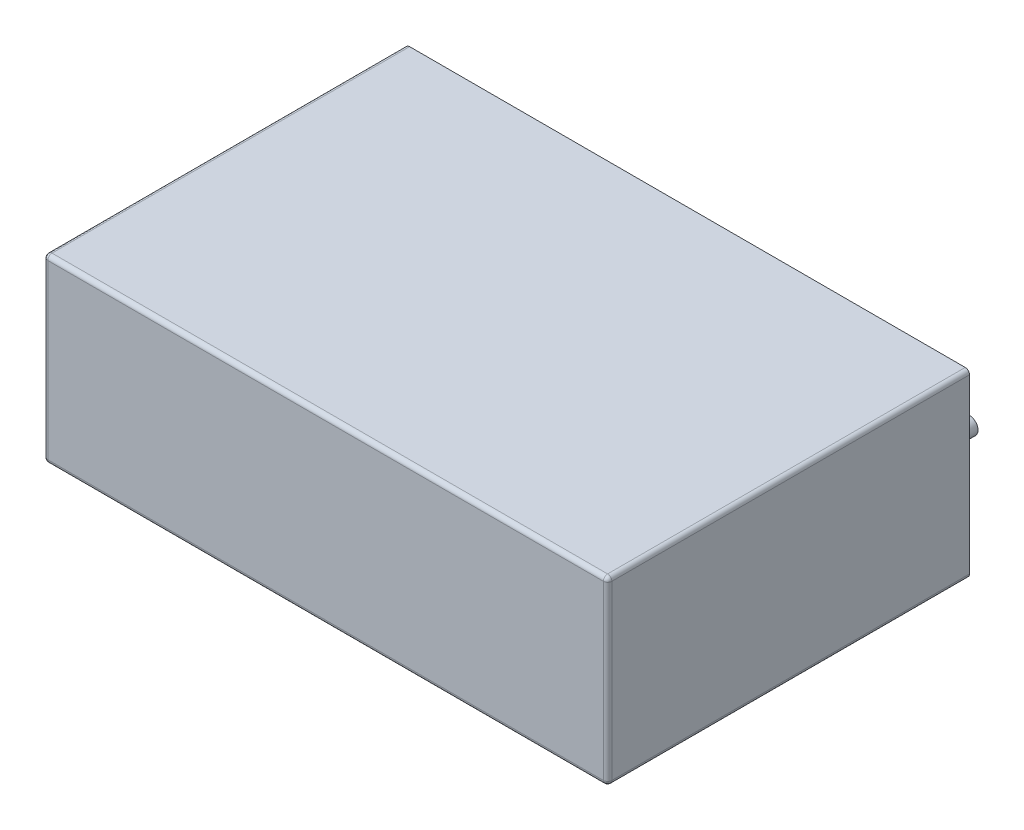
from build123d import *

# Parameters (mm, degrees)
SKETCH1_W               = 26.5
SKETCH1_H               = 8.5
EXTRUDE1_DEPTH          = 17
FILLET1_R               = 0.2
BOSS_EXTRUDE1_DEPTH     = 0.01
SKETCH4_W               = 26
SKETCH4_H               = 8
CUT_EXTRUDE1_DEPTH      = 0.5
CUT_EXTRUDE5_DEPTH      = 24.169214488
CUT_EXTRUDE5_DEPTH_BACK = 6
SKETCH5_W               = 19.5
SKETCH5_H               = 0.4
SKETCH2_R               = 0.4
EXTRUDE2_DEPTH          = 2.5


with BuildPart() as part:
    # Sketch1 → Extrude1 (new body)
    with BuildSketch(Plane.XY):
        Rectangle(SKETCH1_W, SKETCH1_H)
    extrude(amount=EXTRUDE1_DEPTH)

    # Fillet1
    fillet1_edges = [part.edges().sort_by_distance(p)[0] for p in [
        (13.25, 0, 17),
        (0, 4.25, 17),
        (-13.25, 0, 17),
        (0, -4.25, 17),
        (-13.25, 4.25, 8.5),
        (13.25, 4.25, 8.5),
        (13.25, -4.25, 8.5),
        (-13.25, -4.25, 8.5),
    ]]
    fillet(fillet1_edges, radius=FILLET1_R)

    # Sketch3 → Boss-Extrude1 (add)
    # profile 1 of 16: a face of its own
    with BuildSketch(Plane.XZ.offset(4.25)):
        Polygon((-4.080689103, 10.183093136), (-3.871121294, 11.770593136), (-3.85076873, 11.770593136), (-3.195352564, 10.468029033), (-2.541526442, 11.770593136), (-2.520855869, 11.770593136), (-2.310016026, 10.183093136), (-2.453119992, 10.183093136), (-2.605128205, 11.325380796), (-3.178180088, 10.183093136), (-3.210298978, 10.183093136), (-3.785576923, 11.327924866), (-3.937267127, 10.183093136), align=None)
    # profile 2 of 16: a face of its own
    with BuildSketch(Plane.XZ.offset(4.25)):
        Polygon((-1.984375, 11.770593136), (-1.841907051, 11.770593136), (-1.841907051, 11.16605838), (-1.180130709, 11.770593136), (-0.976923077, 11.770593136), (-1.756998698, 11.058253392), (-0.915865385, 10.183093136), (-1.105716647, 10.183093136), (-1.841907051, 10.949176369), (-1.841907051, 10.183093136), (-1.984375, 10.183093136), align=None)
    # profile 3 of 16: a face of its own
    with BuildSketch(Plane.XZ.offset(4.25)):
        with BuildLine():
            Line((-0.681810897, 11.770593136), (-0.370480268, 11.770593136))
            add(Edge.make_bspline(
                [(-0.370480268, 11.770593136), (-0.34906675, 11.770569597), (-0.308037499, 11.770524496), (-0.249202455, 11.769157093), (-0.195767327, 11.767330701), (-0.147847333, 11.764798914), (-0.105295031, 11.761806889), (-0.06830297, 11.757610428), (-0.036580386, 11.753228794), (-0.017572818, 11.748774085), (-0.008904247, 11.746742475)],
                knots=[0, 0, 0, 0, 1.415646017, 2.712440637, 3.8905458, 4.950247383, 5.884950622, 6.709939814, 7.411656543, 8, 8, 8, 8], degree=3))
            add(Edge.make_bspline(
                [(-0.008904247, 11.746742475), (0.002069249, 11.743738947), (0.023757664, 11.737802667), (0.055009208, 11.725912871), (0.084742559, 11.711814889), (0.113059731, 11.695747602), (0.139612747, 11.67702165), (0.164797773, 11.656396116), (0.188392549, 11.633394798), (0.210264395, 11.608275676), (0.230350714, 11.581460438), (0.247645249, 11.552548784), (0.262126526, 11.522027371), (0.274546796, 11.48991743), (0.283485988, 11.455949319), (0.290220117, 11.42035906), (0.294494406, 11.383150469), (0.294903782, 11.357723314), (0.295112179, 11.344779334)],
                knots=[0, 0, 0, 0, 0.999701418, 1.975846123, 2.934577507, 3.890451536, 4.834027766, 5.787354733, 6.749476667, 7.726910423, 8.712836071, 9.690891519, 10.682875813, 11.679750201, 12.712814741, 13.765529915, 14.8625177, 16, 16, 16, 16], degree=3))
            add(Edge.make_bspline(
                [(0.295112179, 11.344779334), (0.294921033, 11.331726556), (0.294547043, 11.306187916), (0.290058371, 11.268825973), (0.284012176, 11.23312156), (0.274715299, 11.199153845), (0.262538869, 11.167124549), (0.248254973, 11.136544205), (0.231026729, 11.107933068), (0.211230682, 11.081187268), (0.189209066, 11.056281701), (0.165055054, 11.033396847), (0.138866161, 11.012666665), (0.110725615, 10.994044681), (0.080359077, 10.977962725), (0.0482271, 10.963558519), (0.014050395, 10.951461288), (-0.00959996, 10.945097653), (-0.021624599, 10.941862166)],
                knots=[0, 0, 0, 0, 1.121902311, 2.195077645, 3.232258892, 4.234102512, 5.217864754, 6.176164875, 7.132989551, 8.084763148, 9.034132444, 9.988522005, 10.94243251, 11.903244335, 12.886203696, 13.894208494, 14.929344452, 16, 16, 16, 16], degree=3))
            add(Edge.make_bspline(
                [(-0.021624599, 10.941862166), (-0.031570212, 10.939747171), (-0.053366599, 10.935112037), (-0.089263477, 10.929937487), (-0.131057991, 10.925520789), (-0.178693096, 10.922209202), (-0.232126035, 10.919374213), (-0.291385713, 10.917120828), (-0.356588455, 10.915882644), (-0.402068626, 10.915818784), (-0.425813802, 10.915785443)],
                knots=[0, 0, 0, 0, 0.601384939, 1.31797006, 2.144135048, 3.087295005, 4.142315834, 5.309527816, 6.595305764, 8, 8, 8, 8], degree=3))
            Line((-0.425813802, 10.915785443), (-0.539342949, 10.915785443))
            Line((-0.539342949, 10.915785443), (-0.539342949, 10.183093136))
            Line((-0.539342949, 10.183093136), (-0.681810897, 10.183093136))
            Line((-0.681810897, 10.183093136), (-0.681810897, 11.770593136))
        make_face()
        with BuildLine():
            Line((-0.539342949, 11.607772623), (-0.539342949, 11.078605956))
            Line((-0.539342949, 11.078605956), (-0.261403245, 11.075107859))
            add(Edge.make_bspline(
                [(-0.261403245, 11.075107859), (-0.247832422, 11.075100845), (-0.221634227, 11.075087305), (-0.18378994, 11.076894889), (-0.148679299, 11.078981559), (-0.116410152, 11.082036781), (-0.086967953, 11.086355352), (-0.06030361, 11.090714962), (-0.036623878, 11.097022037), (-0.008911026, 11.105514286), (0.021969636, 11.119998008), (0.055564559, 11.141020994), (0.084035504, 11.167818315), (0.108672731, 11.197948081), (0.128224326, 11.231466615), (0.142537222, 11.267330026), (0.150946962, 11.305170515), (0.152074628, 11.331064063), (0.152644231, 11.344143316)],
                knots=[0, 0, 0, 0, 1.160613943, 2.240541288, 3.23993089, 4.169200891, 5.011653406, 5.7853311, 6.478053781, 7.106038997, 8.262395093, 9.384106736, 10.481365981, 11.59014053, 12.70357646, 13.786202915, 14.881775077, 16, 16, 16, 16], degree=3))
            add(Edge.make_bspline(
                [(0.152644231, 11.344143316), (0.15207153, 11.356906142), (0.150933073, 11.38227706), (0.142471306, 11.419460283), (0.128252153, 11.454945763), (0.108541484, 11.48804427), (0.084619614, 11.51806562), (0.056815983, 11.544144674), (0.02519604, 11.565109518), (-0.004217265, 11.578641042), (-0.030343517, 11.586902971), (-0.053036585, 11.592683666), (-0.078659141, 11.597299031), (-0.107219526, 11.601036234), (-0.138496376, 11.604235482), (-0.172758397, 11.606406265), (-0.2098758, 11.607676925), (-0.235643452, 11.607739951), (-0.249000901, 11.607772623)],
                knots=[0, 0, 0, 0, 1.120700087, 2.227813068, 3.331159281, 4.466773991, 5.599788987, 6.693661531, 7.80175334, 8.91857717, 9.525282508, 10.207424825, 10.974604443, 11.810962634, 12.737642355, 13.736264703, 14.826523623, 16, 16, 16, 16], degree=3))
            Line((-0.249000901, 11.607772623), (-0.539342949, 11.607772623))
        make_face(mode=Mode.SUBTRACT)
    # profile 4 of 16: a face of its own
    with BuildSketch(Plane.XZ.offset(4.25)):
        Polygon((1.119391026, 11.770593136), (1.283801583, 11.770593136), (1.699439103, 11.121219137), (2.115076623, 11.770593136), (2.279487179, 11.770593136), (1.781803385, 10.992743576), (2.299839744, 10.183093136), (2.135429187, 10.183093136), (1.699439103, 10.864268016), (1.263449018, 10.183093136), (1.099038462, 10.183093136), (1.617392829, 10.992743576), align=None)
    # profile 5 of 16: a face of its own
    with BuildSketch(Plane.XZ.offset(4.25)):
        with BuildLine():
            Line((2.635657051, 11.282131597), (2.493189103, 11.282131597))
            add(Edge.make_bspline(
                [(2.493189103, 11.282131597), (2.494117633, 11.301032321), (2.495941241, 11.33815284), (2.504481215, 11.392274755), (2.516700827, 11.444006753), (2.533978023, 11.492933464), (2.555434799, 11.539487495), (2.581165918, 11.58348393), (2.611643129, 11.624754934), (2.646208326, 11.662917909), (2.683749816, 11.697927986), (2.724256438, 11.728160899), (2.766821862, 11.753704986), (2.811316946, 11.775059692), (2.858243702, 11.791088837), (2.907176284, 11.802982223), (2.958329678, 11.810137923), (2.993182116, 11.810907083), (3.010907452, 11.811298264)],
                knots=[0, 0, 0, 0, 1.10065271, 2.161652631, 3.183658789, 4.190468796, 5.17591951, 6.163126047, 7.15150782, 8.156236427, 9.156009102, 10.134482811, 11.092018607, 12.041330605, 13.001268258, 13.972401359, 14.968799086, 16, 16, 16, 16], degree=3))
            add(Edge.make_bspline(
                [(3.010907452, 11.811298264), (3.02831465, 11.81089075), (3.062519172, 11.810089999), (3.112440157, 11.803213389), (3.159964144, 11.792443067), (3.204998238, 11.777332146), (3.247183132, 11.75701921), (3.286835727, 11.732618183), (3.324428095, 11.704397045), (3.3582676, 11.671171209), (3.389340908, 11.635700841), (3.416148002, 11.597833114), (3.439104687, 11.558721973), (3.458239813, 11.518069182), (3.47232599, 11.475491965), (3.483020392, 11.431610198), (3.489065326, 11.385969659), (3.489993071, 11.355078471), (3.490464744, 11.339373184)],
                knots=[0, 0, 0, 0, 1.111607364, 2.184268762, 3.212621178, 4.221274766, 5.211760367, 6.196651075, 7.1921475, 8.207485113, 9.220403448, 10.201281604, 11.166441695, 12.114753415, 13.065576456, 14.026450734, 14.996634279, 16, 16, 16, 16], degree=3))
            add(Edge.make_bspline(
                [(3.490464744, 11.339373184), (3.489696728, 11.317262559), (3.488174174, 11.273429319), (3.475150153, 11.209015435), (3.454809057, 11.146606991), (3.430317399, 11.096379715), (3.405610255, 11.055905952), (3.383345564, 11.022582646), (3.357281167, 10.986702666), (3.327037706, 10.948386159), (3.293240796, 10.907332999), (3.255584315, 10.863567984), (3.213799735, 10.817543289), (3.184472487, 10.786108248), (3.169275841, 10.769819398)],
                knots=[0, 0, 0, 0, 1.184426356, 2.348067706, 3.509069118, 4.696110526, 5.333549288, 6.050745305, 6.844228056, 7.710549037, 8.667450064, 9.695053472, 10.805634456, 12, 12, 12, 12], degree=3))
            Line((3.169275841, 10.769819398), (2.772082833, 10.345913649))
            Line((2.772082833, 10.345913649), (3.510817308, 10.345913649))
            Line((3.510817308, 10.345913649), (3.510817308, 10.183093136))
            Line((3.510817308, 10.183093136), (2.43213141, 10.183093136))
            Line((2.43213141, 10.183093136), (3.047796474, 10.840099346))
            add(Edge.make_bspline(
                [(3.047796474, 10.840099346), (3.062786052, 10.855746792), (3.091577962, 10.885802334), (3.132300773, 10.929682176), (3.168876314, 10.970390004), (3.201541346, 11.007848902), (3.229587258, 11.042606792), (3.254475734, 11.073537961), (3.27441727, 11.102001587), (3.29605961, 11.134994651), (3.317020952, 11.175277381), (3.335033342, 11.224505161), (3.346016505, 11.275181451), (3.347334056, 11.309427018), (3.347996795, 11.326652831)],
                knots=[0, 0, 0, 0, 1.329631726, 2.553950428, 3.673215718, 4.687767853, 5.603093632, 6.413772471, 7.123043292, 7.734684054, 8.834405432, 9.900288307, 10.943827018, 12, 12, 12, 12], degree=3))
            add(Edge.make_bspline(
                [(3.347996795, 11.326652831), (3.34770844, 11.337484751), (3.347140149, 11.358832385), (3.342124693, 11.390131426), (3.334545285, 11.420323324), (3.3236844, 11.449500948), (3.309348486, 11.47737094), (3.29189806, 11.503967225), (3.271763996, 11.52967972), (3.248472527, 11.553788538), (3.222885873, 11.575868942), (3.195855624, 11.595428795), (3.167257899, 11.611775106), (3.137213272, 11.625175192), (3.105805505, 11.635686883), (3.072973853, 11.642970595), (3.038809031, 11.647543722), (3.015480267, 11.648162471), (3.003593249, 11.648477751)],
                knots=[0, 0, 0, 0, 0.991446411, 1.95395049, 2.89581595, 3.838931463, 4.798493298, 5.75982156, 6.748411868, 7.785213223, 8.824556874, 9.840280684, 10.836137867, 11.835679398, 12.848801643, 13.863922112, 14.911575587, 16, 16, 16, 16], degree=3))
            add(Edge.make_bspline(
                [(3.003593249, 11.648477751), (2.991178621, 11.648153433), (2.966798342, 11.647516525), (2.931002924, 11.643061246), (2.896855446, 11.635375097), (2.864270012, 11.624862819), (2.833191485, 11.611501263), (2.803771008, 11.594858936), (2.776074626, 11.574999995), (2.750050275, 11.552484457), (2.726072684, 11.527416652), (2.705005708, 11.499472133), (2.686597959, 11.469161127), (2.670537342, 11.43656542), (2.657494583, 11.401389241), (2.64752819, 11.363757461), (2.639642013, 11.323833477), (2.637007434, 11.296263099), (2.635657051, 11.282131597)],
                knots=[0, 0, 0, 0, 1.031018746, 2.02475058, 2.990194455, 3.934040569, 4.864654155, 5.795059489, 6.735614925, 7.690564532, 8.649604399, 9.611025574, 10.590972636, 11.591080095, 12.624614302, 13.701020113, 14.821632451, 16, 16, 16, 16], degree=3))
        make_face()
    # profile 6 of 16: a face of its own
    with BuildSketch(Plane.XZ.offset(4.25)):
        Polygon((-2.410188802, 8.165464931), (-2.38125, 8.165464931), (-2.38125, 7.066426469), (-2.198076923, 7.066426469), (-2.198076923, 6.903605956), (-2.38125, 6.903605956), (-2.38125, 6.537259802), (-2.523717949, 6.537259802), (-2.523717949, 6.903605956), (-3.276762821, 6.903605956), align=None)
        Polygon((-2.523717949, 7.066426469), (-2.523717949, 7.755869578), (-2.996915064, 7.066426469), align=None, mode=Mode.SUBTRACT)
    # profile 7 of 16: a face of its own
    with BuildSketch(Plane.XZ.offset(4.25)):
        Polygon((-1.953846154, 8.124759802), (-0.976923077, 8.124759802), (-1.811378205, 6.496554674), (-1.934447616, 6.564290552), (-1.217973758, 7.96193929), (-1.953846154, 7.96193929), align=None)
    # profile 8 of 16: a face of its own
    with BuildSketch(Plane.XZ.offset(4.25)):
        with BuildLine():
            add(Edge.make_bspline(
                [(-0.834455128, 7.330373785), (-0.834306349, 7.355817957), (-0.834017342, 7.405243628), (-0.830802237, 7.477263805), (-0.825461278, 7.544827936), (-0.818141827, 7.607939256), (-0.8092346, 7.666614056), (-0.797344004, 7.720695535), (-0.783821769, 7.770434), (-0.768149766, 7.815991643), (-0.750466019, 7.857982244), (-0.731219051, 7.897182246), (-0.709645019, 7.933532337), (-0.686976919, 7.967612692), (-0.662297158, 7.998865439), (-0.636308064, 8.027731932), (-0.607995285, 8.053545023), (-0.578321277, 8.077061024), (-0.547017381, 8.097675606), (-0.514975886, 8.115833312), (-0.481976249, 8.131345395), (-0.447928373, 8.143542128), (-0.413138284, 8.153616334), (-0.377484365, 8.160505607), (-0.340907746, 8.164840347), (-0.316219202, 8.165254761), (-0.303698417, 8.165464931)],
                knots=[0, 0, 0, 0, 1.646270934, 3.197905019, 4.663502075, 6.030701355, 7.308322542, 8.50163776, 9.611534131, 10.641858119, 11.616356847, 12.558055219, 13.465016945, 14.349605745, 15.204443733, 16.039544428, 16.859896111, 17.680448484, 18.487036065, 19.28249412, 20.06191084, 20.843045899, 21.620316918, 22.403196591, 23.190181807, 24, 24, 24, 24], degree=3))
            add(Edge.make_bspline(
                [(-0.303698417, 8.165464931), (-0.29107304, 8.165243672), (-0.265965136, 8.164803657), (-0.22884468, 8.160574583), (-0.192581788, 8.153557324), (-0.157331061, 8.143614596), (-0.122802942, 8.131279414), (-0.0892675, 8.115818472), (-0.056516431, 8.097821271), (-0.025070194, 8.076674012), (0.005416436, 8.053096337), (0.034194619, 8.026443269), (0.061266976, 7.996983933), (0.086973275, 7.965033516), (0.110584206, 7.929979209), (0.133069299, 7.892430702), (0.153195187, 7.851731346), (0.172578414, 7.808560205), (0.189309297, 7.76172276), (0.204397916, 7.711483029), (0.216589448, 7.657247594), (0.226744582, 7.599301012), (0.234611732, 7.537430475), (0.240341537, 7.47176861), (0.243368258, 7.402272219), (0.243938262, 7.354757051), (0.244230769, 7.330373785)],
                knots=[0, 0, 0, 0, 0.810914788, 1.612654377, 2.396697861, 3.181598691, 3.963628158, 4.749916497, 5.551656086, 6.361998678, 7.18212741, 8.025565596, 8.878627764, 9.750805457, 10.657531673, 11.591944965, 12.560506719, 13.57287815, 14.630710178, 15.753379473, 16.941251878, 18.199788006, 19.531962791, 20.947069417, 22.433333509, 24, 24, 24, 24], degree=3))
            add(Edge.make_bspline(
                [(0.244230769, 7.330373785), (0.243935229, 7.306096869), (0.243359381, 7.25879429), (0.240375468, 7.189610597), (0.234497803, 7.124297199), (0.227145415, 7.062697454), (0.2169623, 7.005067748), (0.204441385, 6.951208659), (0.190539275, 6.900887598), (0.173378493, 6.854516808), (0.154595778, 6.81144942), (0.134160028, 6.771232535), (0.112266214, 6.73351068), (0.088413462, 6.698585795), (0.062989235, 6.666210476), (0.035449381, 6.636956197), (0.006570223, 6.610118071), (-0.024006123, 6.586236797), (-0.055942791, 6.565334046), (-0.088581372, 6.546640621), (-0.122500978, 6.53156722), (-0.156932924, 6.518624541), (-0.192369719, 6.508736479), (-0.228767189, 6.501899409), (-0.265940196, 6.49710432), (-0.291068763, 6.496738524), (-0.303698417, 6.496554674)],
                knots=[0, 0, 0, 0, 1.561518951, 3.042555995, 4.452378317, 5.7783523, 7.031515105, 8.214008947, 9.334062868, 10.386615937, 11.391082383, 12.354592575, 13.286541444, 14.194233754, 15.072674879, 15.931287219, 16.775624067, 17.606195743, 18.42308326, 19.229000347, 20.022332153, 20.807536673, 21.593273796, 22.3848459, 23.188221202, 24, 24, 24, 24], degree=3))
            add(Edge.make_bspline(
                [(-0.303698417, 6.496554674), (-0.316218855, 6.4967662), (-0.340906714, 6.497183287), (-0.377488349, 6.501498443), (-0.412995029, 6.508436047), (-0.447601964, 6.518150006), (-0.481486705, 6.530040307), (-0.514187521, 6.545531442), (-0.546068006, 6.563372252), (-0.577043104, 6.583690175), (-0.606530763, 6.606968225), (-0.634696916, 6.632714884), (-0.660833978, 6.661572646), (-0.685160872, 6.693085846), (-0.708281262, 6.726964567), (-0.729548942, 6.763671365), (-0.749220722, 6.803060692), (-0.767201877, 6.84538703), (-0.783144306, 6.891268015), (-0.79722666, 6.941228535), (-0.808345581, 6.995709556), (-0.81786285, 7.054273505), (-0.825539267, 7.117172037), (-0.830779978, 7.184439301), (-0.834019075, 7.256033378), (-0.834307125, 7.305141454), (-0.834455128, 7.330373785)],
                knots=[0, 0, 0, 0, 0.810891512, 1.598919785, 2.382837074, 3.152667961, 3.926044502, 4.706494248, 5.493654104, 6.291793342, 7.103789334, 7.925228297, 8.761435821, 9.622817696, 10.50288917, 11.416980706, 12.369136599, 13.353924996, 14.394355917, 15.514179734, 16.714354668, 17.994756427, 19.357759367, 20.818452758, 22.365282078, 24, 24, 24, 24], degree=3))
        make_face()
        with BuildLine():
            add(Edge.make_bspline(
                [(-0.691987179, 7.331009802), (-0.691933002, 7.309805928), (-0.691827853, 7.268653372), (-0.689080934, 7.208853036), (-0.685338864, 7.153077208), (-0.680512276, 7.101255069), (-0.67334451, 7.053562027), (-0.665313217, 7.009670064), (-0.655539619, 6.96981146), (-0.643975807, 6.933712703), (-0.630804503, 6.900761161), (-0.616423629, 6.870099181), (-0.600974658, 6.841364553), (-0.583684901, 6.814815381), (-0.564854854, 6.790365085), (-0.54490984, 6.767580907), (-0.523105489, 6.747262276), (-0.492941292, 6.72289331), (-0.453119319, 6.697711417), (-0.402945042, 6.675783012), (-0.35138828, 6.662002398), (-0.316394677, 6.660249909), (-0.298928285, 6.659375187)],
                knots=[0, 0, 0, 0, 1.459021318, 2.831673884, 4.118529203, 5.306027144, 6.411944654, 7.436330062, 8.375795394, 9.233974572, 10.042671642, 10.816086306, 11.563610507, 12.285937304, 12.993564865, 13.685989202, 14.367179055, 15.041617293, 16.353048772, 17.594441528, 18.799311195, 20, 20, 20, 20], degree=3))
            add(Edge.make_bspline(
                [(-0.298928285, 6.659375187), (-0.281348913, 6.660099895), (-0.246226463, 6.661547814), (-0.194912206, 6.675517241), (-0.145096333, 6.696594497), (-0.10605656, 6.721517115), (-0.076355549, 6.74525175), (-0.055075343, 6.76548768), (-0.035543628, 6.788146234), (-0.01701883, 6.812593415), (-2.8464e-05, 6.839296292), (0.015421602, 6.86812646), (0.029520121, 6.89916398), (0.037552438, 6.920830968), (0.041659155, 6.931908741)],
                knots=[0, 0, 0, 0, 1.353760809, 2.704726607, 4.075137775, 5.516104923, 6.260822281, 7.007110065, 7.778089737, 8.566572457, 9.372053459, 10.217411131, 11.088608312, 12, 12, 12, 12], degree=3))
            add(Edge.make_bspline(
                [(0.041659155, 6.931908741), (0.046445135, 6.946073658), (0.056162728, 6.974834516), (0.06868664, 7.019449458), (0.078549731, 7.066259283), (0.087423115, 7.114984246), (0.09347968, 7.165983682), (0.098354581, 7.219099792), (0.101226, 7.274372624), (0.10158194, 7.311926067), (0.101762821, 7.331009802)],
                knots=[0, 0, 0, 0, 0.884706709, 1.796334032, 2.740027952, 3.714592787, 4.726048262, 5.777819803, 6.87074269, 8, 8, 8, 8], degree=3))
            add(Edge.make_bspline(
                [(0.101762821, 7.331009802), (0.10151327, 7.350090451), (0.101025097, 7.38741628), (0.09915911, 7.442079883), (0.09434056, 7.493999189), (0.088988817, 7.543397868), (0.081097934, 7.590002469), (0.072589929, 7.634203143), (0.061159379, 7.675452301), (0.048949338, 7.714395754), (0.034974623, 7.750591051), (0.019591415, 7.784206947), (0.00316226, 7.815405733), (-0.014682256, 7.84410181), (-0.033730298, 7.870423713), (-0.054484615, 7.89384369), (-0.076121955, 7.915087601), (-0.106428322, 7.939336694), (-0.14610416, 7.964061642), (-0.195473436, 7.986815397), (-0.246849764, 7.999882016), (-0.281581295, 8.001724281), (-0.298928285, 8.002644418)],
                knots=[0, 0, 0, 0, 1.31362396, 2.569729283, 3.763502607, 4.902122613, 5.988968491, 7.01645872, 7.998833611, 8.933434873, 9.825090667, 10.667526885, 11.477055099, 12.250526234, 12.991942729, 13.710640831, 14.402115721, 15.076753259, 16.378508321, 17.609869233, 18.806226677, 20, 20, 20, 20], degree=3))
            add(Edge.make_bspline(
                [(-0.298928285, 8.002644418), (-0.316486304, 8.001723012), (-0.351634327, 7.999878521), (-0.40354465, 7.986864081), (-0.453303409, 7.964179628), (-0.49287433, 7.939254802), (-0.523201833, 7.91551564), (-0.544557198, 7.894929641), (-0.56458064, 7.872411518), (-0.583026347, 7.847736364), (-0.600302557, 7.821218144), (-0.616168945, 7.79264824), (-0.630464305, 7.761881871), (-0.64365622, 7.728945131), (-0.655255306, 7.692849488), (-0.664822925, 7.65303998), (-0.673661696, 7.609287622), (-0.679918835, 7.561336274), (-0.685481325, 7.509501154), (-0.689056079, 7.453586085), (-0.691837042, 7.393685455), (-0.691936131, 7.352320123), (-0.691987179, 7.331009802)],
                knots=[0, 0, 0, 0, 1.207732386, 2.417664972, 3.655092373, 4.956220595, 5.625982001, 6.301752483, 6.994047911, 7.697131622, 8.419323945, 9.170223765, 9.943494443, 10.752040957, 11.610060368, 12.549350801, 13.567764191, 14.679664412, 15.874934091, 17.154273443, 18.533957287, 20, 20, 20, 20], degree=3))
        make_face(mode=Mode.SUBTRACT)
    # profile 9 of 16: a face of its own
    with BuildSketch(Plane.XZ.offset(4.25)):
        with BuildLine():
            Line((0.488461538, 7.697355956), (0.630929487, 7.697355956))
            Line((0.630929487, 7.697355956), (0.630929487, 7.488106157))
            add(Edge.make_bspline(
                [(0.630929487, 7.488106157), (0.6461412, 7.50708482), (0.67566006, 7.543913579), (0.724820097, 7.592318982), (0.776773938, 7.632208424), (0.831203418, 7.664005502), (0.888182426, 7.687975221), (0.947363641, 7.705286197), (1.009101383, 7.715666102), (1.051085967, 7.717022385), (1.072325721, 7.71770852)],
                knots=[0, 0, 0, 0, 1.12780773, 2.188550248, 3.19190651, 4.159438251, 5.104880172, 6.052711206, 7.014878035, 8, 8, 8, 8], degree=3))
            add(Edge.make_bspline(
                [(1.072325721, 7.71770852), (1.093793544, 7.71691695), (1.135811253, 7.715367655), (1.196988088, 7.703113655), (1.25412602, 7.682183486), (1.307021319, 7.653512297), (1.354704019, 7.617858647), (1.396579934, 7.576321581), (1.431216121, 7.528544144), (1.454437782, 7.484219712), (1.469734772, 7.444900152), (1.479365154, 7.411223947), (1.487543492, 7.373705357), (1.494633606, 7.332457758), (1.499431082, 7.28719215), (1.503214907, 7.23809409), (1.505926672, 7.185179481), (1.506034262, 7.148582332), (1.506089744, 7.129710223)],
                knots=[0, 0, 0, 0, 1.235846778, 2.418850247, 3.575807741, 4.728682307, 5.871620074, 6.994088408, 8.11269785, 9.256955736, 9.865816715, 10.540099792, 11.271859618, 12.076849838, 12.949306005, 13.892391288, 14.913166135, 16, 16, 16, 16], degree=3))
            Line((1.506089744, 7.129710223), (1.506089744, 6.537259802))
            Line((1.506089744, 6.537259802), (1.363621795, 6.537259802))
            Line((1.363621795, 6.537259802), (1.363621795, 7.082962927))
            add(Edge.make_bspline(
                [(1.363621795, 7.082962927), (1.363534161, 7.098757393), (1.363366533, 7.128969519), (1.362837829, 7.172226183), (1.361563381, 7.211454024), (1.359772539, 7.246559259), (1.357151336, 7.277508177), (1.354419642, 7.304363814), (1.351079099, 7.32709207), (1.348102349, 7.34077409), (1.346767328, 7.346910243)],
                knots=[0, 0, 0, 0, 1.430800155, 2.736877192, 3.918605307, 4.986035426, 5.920637409, 6.731861385, 7.431261377, 8, 8, 8, 8], degree=3))
            add(Edge.make_bspline(
                [(1.346767328, 7.346910243), (1.34194789, 7.364922102), (1.332671964, 7.399589358), (1.309751193, 7.446613082), (1.280806904, 7.48661726), (1.245474665, 7.519354559), (1.204095763, 7.544832045), (1.156785023, 7.562509518), (1.103998997, 7.573565897), (1.066872188, 7.574666775), (1.047521034, 7.575240572)],
                knots=[0, 0, 0, 0, 1.084156227, 2.086665306, 3.027808233, 3.945421172, 4.874247719, 5.839848303, 6.874090471, 8, 8, 8, 8], degree=3))
            add(Edge.make_bspline(
                [(1.047521034, 7.575240572), (1.036060334, 7.575024669), (1.013379906, 7.574597405), (0.979747598, 7.570310566), (0.947124848, 7.563299052), (0.915184253, 7.553833635), (0.884564647, 7.540833248), (0.854282272, 7.526078855), (0.825477418, 7.507687345), (0.797535877, 7.48719017), (0.771540425, 7.464475672), (0.747352214, 7.440506913), (0.725790327, 7.414981907), (0.706255606, 7.38831193), (0.689392608, 7.360130704), (0.674672814, 7.330710108), (0.66218341, 7.300011419), (0.655977332, 7.278704873), (0.652872095, 7.268044057)],
                knots=[0, 0, 0, 0, 1.023777757, 2.026029729, 3.023749952, 4.003683103, 4.997618607, 5.993177895, 7.010360494, 8.046726602, 9.087585522, 10.09234134, 11.086953743, 12.070360549, 13.043493632, 14.017870808, 15.008233677, 16, 16, 16, 16], degree=3))
            add(Edge.make_bspline(
                [(0.652872095, 7.268044057), (0.651085183, 7.26021759), (0.647195169, 7.243179781), (0.642993656, 7.215219633), (0.63918022, 7.182875466), (0.635988456, 7.146185022), (0.634035642, 7.105019843), (0.631906398, 7.059555731), (0.631131217, 7.009611399), (0.630998613, 6.974839845), (0.630929487, 6.956713428)],
                knots=[0, 0, 0, 0, 0.615963638, 1.340920617, 2.168419149, 3.115676021, 4.16674242, 5.331190069, 6.6087489, 8, 8, 8, 8], degree=3))
            Line((0.630929487, 6.956713428), (0.630929487, 6.537259802))
            Line((0.630929487, 6.537259802), (0.488461538, 6.537259802))
            Line((0.488461538, 6.537259802), (0.488461538, 7.697355956))
        make_face()
    # profile 10 of 16: a face of its own
    with BuildSketch(Plane.XZ.offset(4.25)):
        Polygon((1.872435897, 8.124759802), (2.645833333, 8.124759802), (2.645833333, 7.96193929), (2.014903846, 7.96193929), (2.014903846, 7.473477751), (2.645833333, 7.473477751), (2.645833333, 7.310657238), (2.014903846, 7.310657238), (2.014903846, 6.537259802), (1.872435897, 6.537259802), align=None)
    # profile 11 of 16: a face of its own
    with BuildSketch(Plane.XZ.offset(4.25)):
        with BuildLine():
            Line((-4.365625, 3.990464931), (-4.508092949, 3.990464931))
            add(Edge.make_bspline(
                [(-4.508092949, 3.990464931), (-4.507164419, 4.009365655), (-4.50534081, 4.046486174), (-4.496800836, 4.100608088), (-4.484581224, 4.152340086), (-4.467304029, 4.201266797), (-4.445847253, 4.247820828), (-4.420116133, 4.291817264), (-4.389638922, 4.333088267), (-4.355073725, 4.371251242), (-4.317532235, 4.406261319), (-4.277025613, 4.436494233), (-4.23446019, 4.462038319), (-4.189965105, 4.483393026), (-4.14303835, 4.49942217), (-4.094105768, 4.511315557), (-4.042952374, 4.518471256), (-4.008099935, 4.519240416), (-3.990374599, 4.519631597)],
                knots=[0, 0, 0, 0, 1.10065271, 2.161652631, 3.183658789, 4.190468796, 5.17591951, 6.163126047, 7.15150782, 8.156236427, 9.156009102, 10.134482811, 11.092018607, 12.041330605, 13.001268258, 13.972401359, 14.968799086, 16, 16, 16, 16], degree=3))
            add(Edge.make_bspline(
                [(-3.990374599, 4.519631597), (-3.972967401, 4.519224083), (-3.938762879, 4.518423332), (-3.888841894, 4.511546723), (-3.841317907, 4.500776401), (-3.796283813, 4.48566548), (-3.754098919, 4.465352543), (-3.714446324, 4.440951517), (-3.676853957, 4.412730379), (-3.643014451, 4.379504542), (-3.611941144, 4.344034175), (-3.585134049, 4.306166447), (-3.562177365, 4.267055307), (-3.543042238, 4.226402515), (-3.528956061, 4.183825299), (-3.51826166, 4.139943532), (-3.512216725, 4.094302992), (-3.51128898, 4.063411805), (-3.510817308, 4.047706517)],
                knots=[0, 0, 0, 0, 1.111607364, 2.184268762, 3.212621178, 4.221274766, 5.211760367, 6.196651075, 7.1921475, 8.207485113, 9.220403448, 10.201281604, 11.166441695, 12.114753415, 13.065576456, 14.026450734, 14.996634279, 16, 16, 16, 16], degree=3))
            add(Edge.make_bspline(
                [(-3.510817308, 4.047706517), (-3.511585323, 4.025595892), (-3.513107877, 3.981762652), (-3.526131898, 3.917348768), (-3.546472994, 3.854940325), (-3.570964652, 3.804713048), (-3.595671797, 3.764239285), (-3.617936487, 3.73091598), (-3.644000884, 3.695035999), (-3.674244345, 3.656719493), (-3.708041255, 3.615666332), (-3.745697737, 3.571901318), (-3.787482316, 3.525876622), (-3.816809564, 3.494441582), (-3.83200621, 3.478152731)],
                knots=[0, 0, 0, 0, 1.184426356, 2.348067706, 3.509069118, 4.696110526, 5.333549288, 6.050745305, 6.844228056, 7.710549037, 8.667450064, 9.695053472, 10.805634456, 12, 12, 12, 12], degree=3))
            Line((-3.83200621, 3.478152731), (-4.229199219, 3.054246982))
            Line((-4.229199219, 3.054246982), (-3.490464744, 3.054246982))
            Line((-3.490464744, 3.054246982), (-3.490464744, 2.891426469))
            Line((-3.490464744, 2.891426469), (-4.569150641, 2.891426469))
            Line((-4.569150641, 2.891426469), (-3.953485577, 3.548432679))
            add(Edge.make_bspline(
                [(-3.953485577, 3.548432679), (-3.938496, 3.564080125), (-3.90970409, 3.594135667), (-3.868981278, 3.63801551), (-3.832405737, 3.678723337), (-3.799740705, 3.716182236), (-3.771694794, 3.750940125), (-3.746806317, 3.781871295), (-3.726864781, 3.81033492), (-3.705222441, 3.843327984), (-3.684261099, 3.883610714), (-3.666248709, 3.932838494), (-3.655265546, 3.983514784), (-3.653947996, 4.017760351), (-3.653285256, 4.034986165)],
                knots=[0, 0, 0, 0, 1.329631726, 2.553950428, 3.673215718, 4.687767853, 5.603093632, 6.413772471, 7.123043292, 7.734684054, 8.834405432, 9.900288307, 10.943827018, 12, 12, 12, 12], degree=3))
            add(Edge.make_bspline(
                [(-3.653285256, 4.034986165), (-3.653573611, 4.045818085), (-3.654141902, 4.067165719), (-3.659157358, 4.09846476), (-3.666736766, 4.128656657), (-3.677597651, 4.157834281), (-3.691933565, 4.185704273), (-3.709383991, 4.212300559), (-3.729518056, 4.238013054), (-3.752809524, 4.262121871), (-3.778396178, 4.284202275), (-3.805426427, 4.303762128), (-3.834024153, 4.320108439), (-3.86406878, 4.333508525), (-3.895476546, 4.344020216), (-3.928308198, 4.351303929), (-3.96247302, 4.355877055), (-3.985801784, 4.356495805), (-3.997688802, 4.356811084)],
                knots=[0, 0, 0, 0, 0.991446411, 1.95395049, 2.89581595, 3.838931463, 4.798493298, 5.75982156, 6.748411868, 7.785213223, 8.824556874, 9.840280684, 10.836137867, 11.835679398, 12.848801643, 13.863922112, 14.911575587, 16, 16, 16, 16], degree=3))
            add(Edge.make_bspline(
                [(-3.997688802, 4.356811084), (-4.01010343, 4.356486766), (-4.034483709, 4.355849859), (-4.070279127, 4.351394579), (-4.104426605, 4.34370843), (-4.13701204, 4.333196153), (-4.168090566, 4.319834597), (-4.197511043, 4.30319227), (-4.225207425, 4.283333328), (-4.251231777, 4.26081779), (-4.275209367, 4.235749985), (-4.296276343, 4.207805466), (-4.314684092, 4.17749446), (-4.330744709, 4.144898753), (-4.343787468, 4.109722574), (-4.353753862, 4.072090794), (-4.361640038, 4.03216681), (-4.364274617, 4.004596432), (-4.365625, 3.990464931)],
                knots=[0, 0, 0, 0, 1.031018746, 2.02475058, 2.990194455, 3.934040569, 4.864654155, 5.795059489, 6.735614925, 7.690564532, 8.649604399, 9.611025574, 10.590972636, 11.591080095, 12.624614302, 13.701020113, 14.821632451, 16, 16, 16, 16], degree=3))
        make_face()
    # profile 12 of 16: a face of its own
    with BuildSketch(Plane.XZ.offset(4.25)):
        Polygon((-3.246233974, 4.478926469), (-2.269310897, 4.478926469), (-3.103766026, 2.850721341), (-3.226835437, 2.918457218), (-2.510361579, 4.316105956), (-3.246233974, 4.316105956), align=None)
    # profile 13 of 16: a face of its own
    with BuildSketch(Plane.XZ.offset(4.25)):
        with BuildLine():
            Line((-1.129567308, 4.478926469), (-1.129567308, 4.316105956))
            Line((-1.129567308, 4.316105956), (-1.669546274, 4.316105956))
            Line((-1.669546274, 4.316105956), (-1.755090645, 3.898560383))
            add(Edge.make_bspline(
                [(-1.755090645, 3.898560383), (-1.738283159, 3.903200542), (-1.705721314, 3.912190116), (-1.657660948, 3.922171305), (-1.612035199, 3.928188132), (-1.582428156, 3.92900969), (-1.568101462, 3.929407238)],
                knots=[0, 0, 0, 0, 1.100273476, 2.13160584, 3.095893838, 4, 4, 4, 4], degree=3))
            add(Edge.make_bspline(
                [(-1.568101462, 3.929407238), (-1.550374195, 3.929023546), (-1.515517957, 3.928269111), (-1.464518864, 3.921024737), (-1.41583573, 3.90962199), (-1.369570369, 3.893692324), (-1.325637191, 3.873322553), (-1.284440404, 3.847877222), (-1.245361636, 3.818153176), (-1.20910196, 3.783978831), (-1.176207006, 3.746367955), (-1.147284575, 3.705928492), (-1.122717971, 3.663053445), (-1.102960057, 3.617333169), (-1.087182877, 3.569273125), (-1.076681794, 3.518367632), (-1.069689215, 3.46509652), (-1.06890799, 3.428672662), (-1.068509615, 3.410098845)],
                knots=[0, 0, 0, 0, 1.052922333, 2.070308379, 3.05430497, 4.020497103, 4.973039431, 5.925935799, 6.892292201, 7.88610001, 8.88166317, 9.857072816, 10.836096531, 11.812156883, 12.81219415, 13.836441305, 14.89672472, 16, 16, 16, 16], degree=3))
            add(Edge.make_bspline(
                [(-1.068509615, 3.410098845), (-1.068811275, 3.397161981), (-1.069410516, 3.371463083), (-1.072457876, 3.333297677), (-1.078325147, 3.29594025), (-1.08620265, 3.259385843), (-1.096427247, 3.223703664), (-1.108804782, 3.188791578), (-1.123952266, 3.154866881), (-1.140567211, 3.121608577), (-1.159275435, 3.08976854), (-1.180039258, 3.059992035), (-1.201976463, 3.031832379), (-1.225580949, 3.005591579), (-1.251072114, 2.981442067), (-1.278141242, 2.959240525), (-1.306572333, 2.938611493), (-1.336805246, 2.920392347), (-1.368166301, 2.903627007), (-1.401108385, 2.889873116), (-1.434881631, 2.877576555), (-1.469972128, 2.867775091), (-1.506300393, 2.860094968), (-1.543926309, 2.854878624), (-1.582652542, 2.851079312), (-1.608902994, 2.850841478), (-1.622162961, 2.850721341)],
                knots=[0, 0, 0, 0, 1.056347294, 2.098418968, 3.122841568, 4.141288669, 5.149314143, 6.15115421, 7.162517403, 8.180376062, 9.185164535, 10.17417709, 11.141909838, 12.097768115, 13.052685741, 14.0056014, 14.954263652, 15.917497458, 16.885230207, 17.854509472, 18.828990115, 19.81800267, 20.826176721, 21.857883937, 22.917946725, 24, 24, 24, 24], degree=3))
            add(Edge.make_bspline(
                [(-1.622162961, 2.850721341), (-1.637980893, 2.851034685), (-1.669100805, 2.851651153), (-1.714694062, 2.858100252), (-1.758561044, 2.867336743), (-1.800348626, 2.881232479), (-1.840431306, 2.898643859), (-1.878269467, 2.920649409), (-1.914829944, 2.945586359), (-1.948626475, 2.975014234), (-1.979993713, 3.007179561), (-2.008072736, 3.042085348), (-2.033079751, 3.079155488), (-2.054614301, 3.118570008), (-2.072983046, 3.160225341), (-2.087413416, 3.20427756), (-2.099060384, 3.25049649), (-2.103987721, 3.282316118), (-2.106490385, 3.298477751)],
                knots=[0, 0, 0, 0, 1.0467383, 2.05933395, 3.04377827, 4.011590433, 4.970194871, 5.932262533, 6.905835911, 7.896367577, 8.894135286, 9.877477877, 10.858688626, 11.851381753, 12.8477658, 13.868841284, 14.917554742, 16, 16, 16, 16], degree=3))
            Line((-2.106490385, 3.298477751), (-1.964022436, 3.298477751))
            add(Edge.make_bspline(
                [(-1.964022436, 3.298477751), (-1.960516983, 3.283339146), (-1.953779308, 3.254241906), (-1.938990272, 3.213360905), (-1.92090825, 3.1769304), (-1.899406992, 3.144468482), (-1.873757514, 3.116161544), (-1.844488809, 3.090935233), (-1.811673948, 3.068177228), (-1.775209876, 3.049207616), (-1.736741087, 3.033029289), (-1.696478817, 3.022256198), (-1.655519345, 3.014681151), (-1.627815942, 3.013922888), (-1.613894732, 3.013541854)],
                knots=[0, 0, 0, 0, 1.136247022, 2.183929868, 3.172523383, 4.106158343, 5.02341133, 5.958108904, 6.928429099, 7.938127109, 8.96079061, 9.975095812, 10.982467395, 12, 12, 12, 12], degree=3))
            add(Edge.make_bspline(
                [(-1.613894732, 3.013541854), (-1.600306437, 3.013914135), (-1.573550974, 3.01464716), (-1.53417581, 3.020289141), (-1.496160684, 3.028978468), (-1.459880705, 3.041982295), (-1.424701006, 3.057786863), (-1.391511475, 3.078068344), (-1.359351956, 3.101409138), (-1.329222052, 3.128150181), (-1.301627016, 3.157618578), (-1.277244776, 3.189131539), (-1.256935247, 3.222748823), (-1.239820133, 3.257888432), (-1.226823816, 3.294935492), (-1.217552371, 3.333716382), (-1.212108126, 3.374326891), (-1.211359198, 3.402026185), (-1.210977564, 3.416141012)],
                knots=[0, 0, 0, 0, 1.027316725, 2.022795036, 3.002884548, 3.971462791, 4.93288096, 5.914575861, 6.907176829, 7.935150275, 8.956128384, 9.956726525, 10.942570165, 11.921478529, 12.907843606, 13.90538589, 14.932640048, 16, 16, 16, 16], degree=3))
            add(Edge.make_bspline(
                [(-1.210977564, 3.416141012), (-1.211276232, 3.428875371), (-1.211860831, 3.453801066), (-1.216637196, 3.490267849), (-1.224945252, 3.524772408), (-1.236476797, 3.557481364), (-1.25111786, 3.588425568), (-1.26900958, 3.617636956), (-1.290487728, 3.644730516), (-1.315022264, 3.669718925), (-1.341900018, 3.692780707), (-1.37158343, 3.712440346), (-1.403451325, 3.728979337), (-1.43711975, 3.743252322), (-1.473389544, 3.753503375), (-1.511542445, 3.761199523), (-1.551990452, 3.765651491), (-1.579645014, 3.766269205), (-1.593860176, 3.766586725)],
                knots=[0, 0, 0, 0, 1.045622112, 2.046656509, 3.013763289, 3.955457236, 4.890082067, 5.820317437, 6.762574623, 7.722996705, 8.69280354, 9.665887285, 10.63943826, 11.638615906, 12.663482002, 13.728887084, 14.832589034, 16, 16, 16, 16], degree=3))
            add(Edge.make_bspline(
                [(-1.593860176, 3.766586725), (-1.606165083, 3.766323386), (-1.631571594, 3.765779657), (-1.670543734, 3.76177621), (-1.711497479, 3.755317673), (-1.75427584, 3.74643391), (-1.799007285, 3.734808386), (-1.845597416, 3.720877166), (-1.894144195, 3.704221117), (-1.926854734, 3.691642577), (-1.943669872, 3.685176469)],
                knots=[0, 0, 0, 0, 0.817624296, 1.688186739, 2.600797293, 3.572016777, 4.590301741, 5.671205678, 6.80286297, 8, 8, 8, 8], degree=3))
            Line((-1.943669872, 3.685176469), (-1.780849359, 4.478926469))
            Line((-1.780849359, 4.478926469), (-1.129567308, 4.478926469))
        make_face()
    # profile 14 of 16: a face of its own
    with BuildSketch(Plane.XZ.offset(4.25)):
        Polygon((-0.885336538, 4.478926469), (-0.732692308, 4.478926469), (-0.203525641, 3.227879794), (0.325641026, 4.478926469), (0.478285256, 4.478926469), (-0.193349359, 2.891426469), (-0.213701923, 2.891426469), align=None)
    # profile 15 of 16: a face of its own
    with BuildSketch(Plane.XZ.offset(4.25)):
        Polygon((2.025080128, 4.478926469), (2.757772436, 2.891426469), (2.602902143, 2.891426469), (2.368211639, 3.400240572), (1.648557692, 3.400240572), (1.407189002, 2.891426469), (1.251682692, 2.891426469), (2.004727564, 4.478926469), align=None)
        Polygon((2.013313802, 4.169503893), (1.725833834, 3.563061084), (2.293161558, 3.563061084), align=None, mode=Mode.SUBTRACT)
    # profile 16 of 16: a face of its own
    with BuildSketch(Plane.XZ.offset(4.25)):
        with BuildLine():
            Line((4.508092949, 4.187630395), (4.383433494, 4.092227751))
            add(Edge.make_bspline(
                [(4.383433494, 4.092227751), (4.374540823, 4.102825887), (4.356875374, 4.123879274), (4.32845495, 4.153442853), (4.29883599, 4.181140311), (4.268029817, 4.207103592), (4.235481931, 4.230424768), (4.201980783, 4.252319161), (4.166965955, 4.271944171), (4.118546419, 4.295739883), (4.055206145, 4.320571174), (3.975470628, 4.341391568), (3.892235237, 4.354645459), (3.835449183, 4.356080941), (3.806565505, 4.356811084)],
                knots=[0, 0, 0, 0, 0.757959112, 1.505699292, 2.245454638, 2.979532153, 3.711538275, 4.438200793, 5.171680507, 5.909471876, 7.393775596, 8.890124382, 10.418191784, 12, 12, 12, 12], degree=3))
            add(Edge.make_bspline(
                [(3.806565505, 4.356811084), (3.790652723, 4.356627859), (3.758974844, 4.356263107), (3.711962858, 4.351451111), (3.665828724, 4.344687812), (3.620602452, 4.334652398), (3.57634161, 4.321964817), (3.532756842, 4.306804004), (3.490479177, 4.288046631), (3.448923761, 4.26731467), (3.409109619, 4.243897936), (3.371438223, 4.218355809), (3.336046966, 4.190974111), (3.302907852, 4.161650217), (3.271987004, 4.130516185), (3.243508474, 4.097240215), (3.217570806, 4.061928694), (3.19365987, 4.025047255), (3.172245523, 3.986703328), (3.154315899, 3.946754993), (3.138438576, 3.905886346), (3.12587499, 3.863635641), (3.115930656, 3.820300172), (3.10906918, 3.775763636), (3.104311909, 3.730119074), (3.103948972, 3.699181279), (3.103766026, 3.683586425)],
                knots=[0, 0, 0, 0, 1.054917814, 2.100044995, 3.131103042, 4.146048494, 5.169673617, 6.183595914, 7.203665975, 8.234915748, 9.262203917, 10.264457458, 11.251630812, 12.227803204, 13.197192746, 14.159520551, 15.12972552, 16.100847026, 17.073214652, 18.039054194, 19.002613845, 19.979014051, 20.95965708, 21.949030935, 22.966165397, 24, 24, 24, 24], degree=3))
            add(Edge.make_bspline(
                [(3.103766026, 3.683586425), (3.104338351, 3.660122576), (3.105462035, 3.614054422), (3.115462529, 3.546576323), (3.130659482, 3.481933018), (3.153435833, 3.420528589), (3.181520545, 3.36160587), (3.217008251, 3.306161818), (3.258109323, 3.253358591), (3.30540522, 3.204444111), (3.35729643, 3.1597611), (3.412971375, 3.120413515), (3.472291392, 3.08761355), (3.534601506, 3.06031946), (3.600381208, 3.03933873), (3.669512207, 3.024568574), (3.741844148, 3.014933728), (3.791269554, 3.014011305), (3.816423778, 3.013541854)],
                knots=[0, 0, 0, 0, 1.029171465, 2.020641659, 2.987623507, 3.938342917, 4.889210282, 5.84687017, 6.821220943, 7.821438502, 8.827599549, 9.822697543, 10.807740252, 11.797342354, 12.80366471, 13.83203677, 14.896651826, 16, 16, 16, 16], degree=3))
            add(Edge.make_bspline(
                [(3.816423778, 3.013541854), (3.844138212, 3.014307836), (3.898686848, 3.015815472), (3.978682345, 3.028587703), (4.055261425, 3.04929683), (4.128428205, 3.078279102), (4.19797642, 3.115955143), (4.264014905, 3.161628823), (4.326599403, 3.215734603), (4.364232806, 3.257047307), (4.383433494, 3.278125187)],
                knots=[0, 0, 0, 0, 1.028121516, 2.023589091, 2.998037872, 3.967518031, 4.937445131, 5.927275754, 6.942489185, 8, 8, 8, 8], degree=3))
            Line((4.383433494, 3.278125187), (4.508092949, 3.183676569))
            add(Edge.make_bspline(
                [(4.508092949, 3.183676569), (4.498060806, 3.170732343), (4.478044574, 3.144905892), (4.445633259, 3.108496938), (4.411489628, 3.074250465), (4.375360074, 3.042442579), (4.337660218, 3.012436804), (4.297713134, 2.985085616), (4.256043965, 2.960007251), (4.212793898, 2.937044324), (4.168008884, 2.916671144), (4.121742587, 2.899229614), (4.074194433, 2.884205111), (4.025362249, 2.871844411), (3.975144745, 2.862196455), (3.923723137, 2.855746817), (3.870986444, 2.851328163), (3.835407656, 2.850925429), (3.817377804, 2.850721341)],
                knots=[0, 0, 0, 0, 0.986787822, 1.968848986, 2.935600012, 3.899624008, 4.868462664, 5.837806735, 6.815139263, 7.798259679, 8.787526145, 9.778297419, 10.776456485, 11.791383307, 12.812564526, 13.85620153, 14.913611965, 16, 16, 16, 16], degree=3))
            add(Edge.make_bspline(
                [(3.817377804, 2.850721341), (3.800303713, 2.850840173), (3.76654181, 2.851075149), (3.716694877, 2.854881597), (3.66816746, 2.86007487), (3.621098254, 2.867894501), (3.575230401, 2.877122113), (3.530979708, 2.889491575), (3.487910737, 2.903347805), (3.446196526, 2.919633281), (3.40580159, 2.938010263), (3.366856219, 2.958780006), (3.329378323, 2.981767852), (3.292999435, 3.006467089), (3.25825696, 3.033671079), (3.224849825, 3.063002017), (3.192590702, 3.094361043), (3.172632341, 3.11697378), (3.162597656, 3.128343036)],
                knots=[0, 0, 0, 0, 1.114604814, 2.203992996, 3.262667896, 4.300477797, 5.318619304, 6.316056647, 7.298880507, 8.271930387, 9.238335007, 10.195173496, 11.151986948, 12.108099108, 13.064862484, 14.031167946, 15.010108607, 16, 16, 16, 16], degree=3))
            add(Edge.make_bspline(
                [(3.162597656, 3.128343036), (3.146525061, 3.148092075), (3.114573912, 3.187351726), (3.073695477, 3.250981439), (3.038703551, 3.317415233), (3.010411615, 3.38700213), (2.988294232, 3.45958598), (2.972972048, 3.535203374), (2.963015427, 3.613783691), (2.961876832, 3.667231091), (2.961298077, 3.694398725)],
                knots=[0, 0, 0, 0, 0.994628077, 1.977248131, 2.950237994, 3.925870899, 4.908910175, 5.911660606, 6.938484602, 8, 8, 8, 8], degree=3))
            add(Edge.make_bspline(
                [(2.961298077, 3.694398725), (2.962003468, 3.72295352), (2.963391282, 3.779133296), (2.975182232, 3.861580768), (2.994150043, 3.940570867), (3.021090775, 4.015956136), (3.05524713, 4.088133085), (3.097441344, 4.156550346), (3.147183227, 4.221645466), (3.204082659, 4.282430728), (3.266479272, 4.338011077), (3.333298877, 4.386908891), (3.404410689, 4.427602193), (3.479031286, 4.461618309), (3.557719434, 4.487764191), (3.640307248, 4.506067243), (3.726639541, 4.51745965), (3.785541427, 4.518899833), (3.815469752, 4.519631597)],
                knots=[0, 0, 0, 0, 1.032925535, 2.032216505, 3.007276963, 3.968222605, 4.92396291, 5.891752235, 6.871517503, 7.883894988, 8.900124299, 9.891468569, 10.874487609, 11.85992873, 12.854644235, 13.869047385, 14.917252991, 16, 16, 16, 16], degree=3))
            add(Edge.make_bspline(
                [(3.815469752, 4.519631597), (3.833709887, 4.519412913), (3.869814398, 4.51898005), (3.923223637, 4.51475905), (3.975222121, 4.507722521), (4.025845674, 4.498144875), (4.075340575, 4.486257983), (4.123328541, 4.470772919), (4.17009116, 4.453067064), (4.215333507, 4.432675188), (4.258838514, 4.409784916), (4.30059263, 4.384649973), (4.340264191, 4.357301518), (4.378132347, 4.327972149), (4.413563629, 4.296041374), (4.447564013, 4.262387465), (4.47897886, 4.226041051), (4.498370487, 4.200457385), (4.508092949, 4.187630395)],
                knots=[0, 0, 0, 0, 1.096760587, 2.17092713, 3.219439832, 4.250915756, 5.268269357, 6.278326846, 7.281116186, 8.274029601, 9.260640565, 10.235837813, 11.203064059, 12.156899882, 13.114053108, 14.069676657, 15.032185724, 16, 16, 16, 16], degree=3))
        make_face()
    extrude(amount=BOSS_EXTRUDE1_DEPTH)

    # Sketch4 → Cut-Extrude1 (cut)
    with BuildSketch(Plane(origin=(0, 0, 0), x_dir=(-1, 0, 0), z_dir=(0, 0, -1))):
        Rectangle(SKETCH4_W, SKETCH4_H)
    extrude(amount=-CUT_EXTRUDE1_DEPTH, mode=Mode.SUBTRACT)

    # Sketch5 → Cut-Extrude5 (cut, two sides: drawn at the far end of the back side and taken through both)
    with BuildSketch(Plane.XZ.offset(4.25).offset(-CUT_EXTRUDE5_DEPTH_BACK)):
        with Locations((0, 0.2)):
            Rectangle(SKETCH5_W, SKETCH5_H)
    extrude(amount=CUT_EXTRUDE5_DEPTH + CUT_EXTRUDE5_DEPTH_BACK, mode=Mode.SUBTRACT)

    # Sketch2 → Extrude2 (add)
    with BuildSketch(Plane(origin=(0, 0, 0.5), x_dir=(-1, 0, 0), z_dir=(0, 0, -1))):
        with Locations((-11.25, 0)):
            Circle(SKETCH2_R)
        with Locations((11.25, 0)):
            Circle(SKETCH2_R)
    extrude(amount=EXTRUDE2_DEPTH)


solid = part.part
